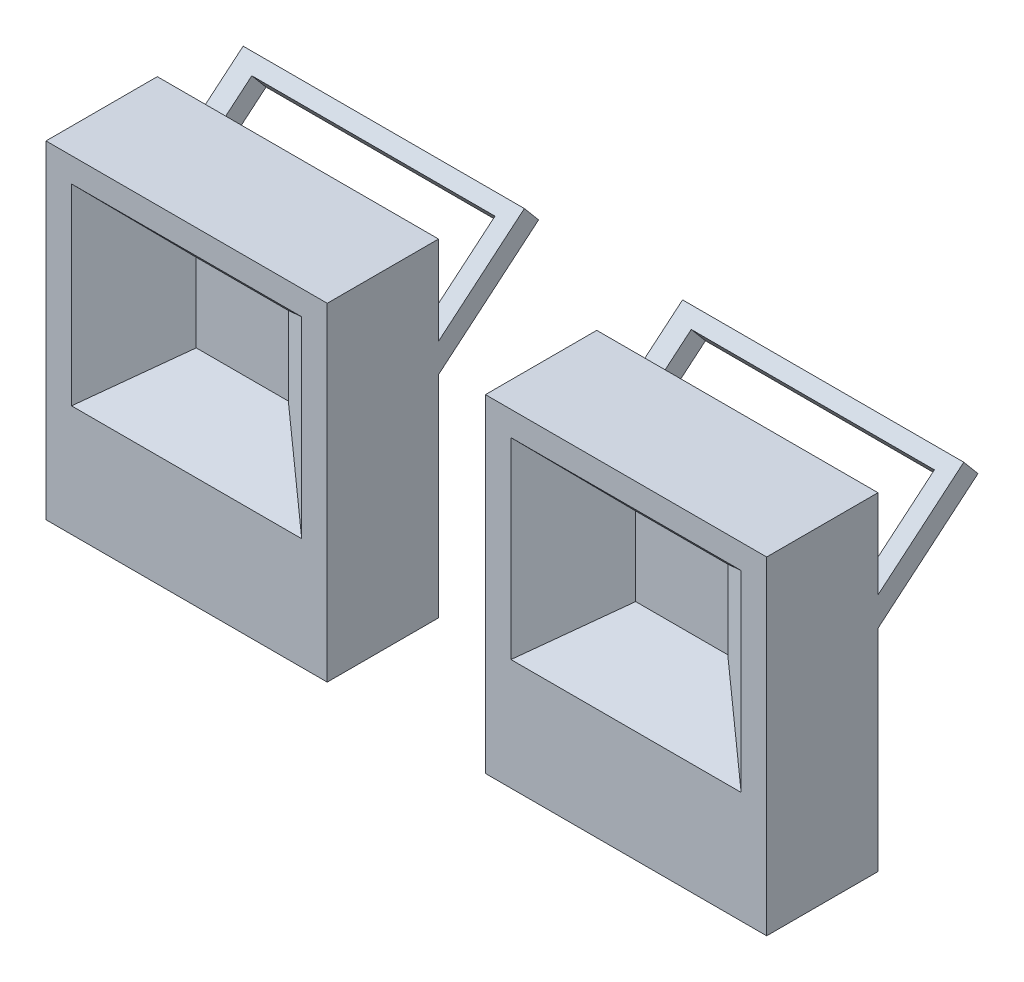
from build123d import *

# Parameters (mm, degrees)
SKETCH1_W           = 96
SKETCH1_H           = 112
BOSS_EXTRUDE1_DEPTH = 19
BOSS_EXTRUDE2_DEPTH = 96
SKETCH6_W           = 83.002539883
SKETCH6_H           = 35.774921173
CUT_EXTRUDE1_DEPTH  = 7.537271128
LPATTERN1_COUNT     = 2
LPATTERN1_PITCH     = 150


with BuildPart() as part:
    # Sketch1 → Boss-Extrude1 (new, symmetric)
    with BuildSketch(Plane.XY):
        Rectangle(SKETCH1_W, SKETCH1_H)
    extrude(amount=BOSS_EXTRUDE1_DEPTH, both=True)

    # Sketch3 → Cut-Loft1 section 0
    with BuildSketch(Plane.XY.offset(19)):
        with BuildLine():
            Line((-39.283492673, 47.646542187), (39.283492673, 47.646542187))
            Line((39.283492673, 47.646542187), (39.283492673, -17.960645348))
            Line((39.283492673, -17.960645348), (-39.283492673, -17.960645348))
            Line((-39.283492673, -17.960645348), (-39.283492673, 47.646542187))
        make_face()
    # Sketch2 → Cut-Loft1 section 1
    with BuildSketch(Plane.XY):
        with BuildLine():
            Line((-15.720976008, 28.233798528), (15.720976008, 28.233798528))
            Line((15.720976008, 28.233798528), (15.720976008, 1.452098312))
            Line((15.720976008, 1.452098312), (-15.720976008, 1.452098312))
            Line((-15.720976008, 1.452098312), (-15.720976008, 28.233798528))
        make_face()
    loft(mode=Mode.SUBTRACT)

    # Sketch5 → Boss-Extrude2 (add)
    with BuildSketch(Plane.ZY.offset(48)):
        Polygon((0, 0), (-53.141322653, 44.590864239), (-48.296458161, 50.364748903), (0, 9.839208673), align=None)
    extrude(amount=-BOSS_EXTRUDE2_DEPTH)

    # Sketch6 → Cut-Extrude1 (cut)
    with BuildSketch(Plane(origin=(0, 0, 0), x_dir=(1, 0, 0), z_dir=(0, -0.7660444431189795, -0.6427876096865377))):
        with Locations((0.413341486, -46.327525207)):
            Rectangle(SKETCH6_W, SKETCH6_H)
    extrude(amount=-CUT_EXTRUDE1_DEPTH, mode=Mode.SUBTRACT)


with BuildPart() as lpattern1_1:
    # LPattern1: pattern copy
    add(part.part.moved(Location(Vector(1, 0, 0) * (1 * LPATTERN1_PITCH))))


solid = Compound([part.part, lpattern1_1.part])
